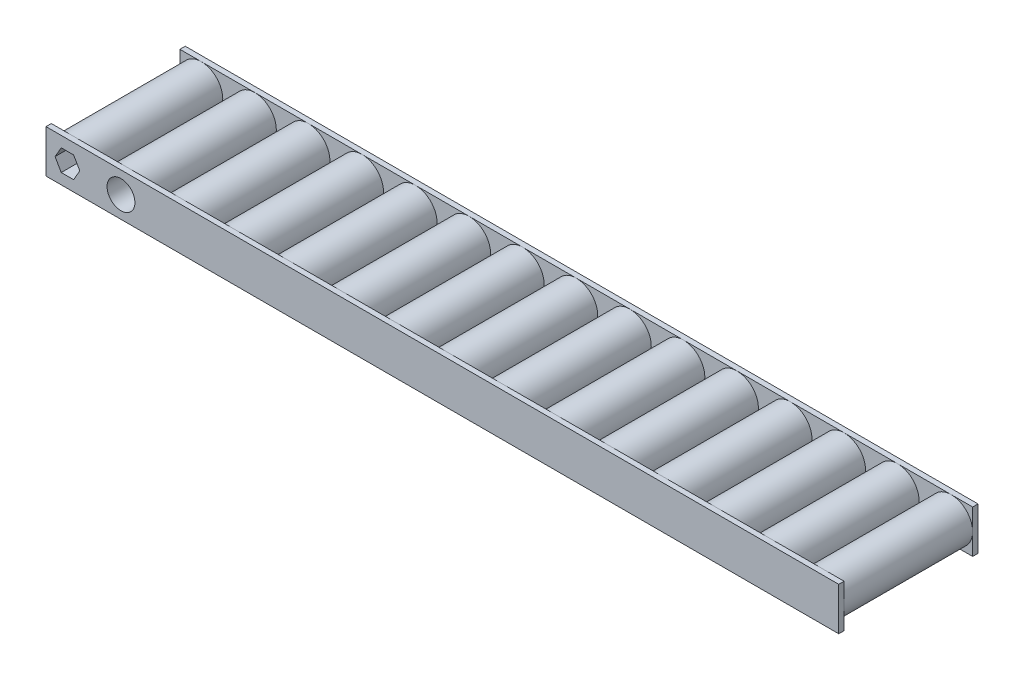
from build123d import *

# Parameters (mm, degrees)
SKETCH1_R           = 12.7
BOSS_EXTRUDE1_DEPTH = 76.2
LPATTERN1_COUNT     = 15
LPATTERN1_PITCH     = 31.75
SKETCH2_W           = 469.9
SKETCH2_H           = 25.4
BOSS_EXTRUDE2_DEPTH = 3.175
SKETCH3_R           = 8.255
CUT_EXTRUDE1_DEPTH  = 465.766212735


with BuildPart() as part:
    # Sketch1 → Boss-Extrude1 (new body)
    with BuildSketch(Plane.XY):
        with Locations(Location((0, 0, 0), (0, 0, 180))):
            Circle(SKETCH1_R)
    extrude(amount=BOSS_EXTRUDE1_DEPTH)


with BuildPart() as lpattern1_1:
    # LPattern1: pattern copy
    add(part.part.moved(Location(Vector(1, 0, 0) * (1 * LPATTERN1_PITCH))))


with BuildPart() as lpattern1_2:
    # LPattern1: pattern copy
    add(part.part.moved(Location(Vector(1, 0, 0) * (2 * LPATTERN1_PITCH))))


with BuildPart() as lpattern1_3:
    # LPattern1: pattern copy
    add(part.part.moved(Location(Vector(1, 0, 0) * (3 * LPATTERN1_PITCH))))


with BuildPart() as lpattern1_4:
    # LPattern1: pattern copy
    add(part.part.moved(Location(Vector(1, 0, 0) * (4 * LPATTERN1_PITCH))))


with BuildPart() as lpattern1_5:
    # LPattern1: pattern copy
    add(part.part.moved(Location(Vector(1, 0, 0) * (5 * LPATTERN1_PITCH))))


with BuildPart() as lpattern1_6:
    # LPattern1: pattern copy
    add(part.part.moved(Location(Vector(1, 0, 0) * (6 * LPATTERN1_PITCH))))


with BuildPart() as lpattern1_7:
    # LPattern1: pattern copy
    add(part.part.moved(Location(Vector(1, 0, 0) * (7 * LPATTERN1_PITCH))))


with BuildPart() as lpattern1_8:
    # LPattern1: pattern copy
    add(part.part.moved(Location(Vector(1, 0, 0) * (8 * LPATTERN1_PITCH))))


with BuildPart() as lpattern1_9:
    # LPattern1: pattern copy
    add(part.part.moved(Location(Vector(1, 0, 0) * (9 * LPATTERN1_PITCH))))


with BuildPart() as lpattern1_10:
    # LPattern1: pattern copy
    add(part.part.moved(Location(Vector(1, 0, 0) * (10 * LPATTERN1_PITCH))))


with BuildPart() as lpattern1_11:
    # LPattern1: pattern copy
    add(part.part.moved(Location(Vector(1, 0, 0) * (11 * LPATTERN1_PITCH))))


with BuildPart() as lpattern1_12:
    # LPattern1: pattern copy
    add(part.part.moved(Location(Vector(1, 0, 0) * (12 * LPATTERN1_PITCH))))


with BuildPart() as lpattern1_13:
    # LPattern1: pattern copy
    add(part.part.moved(Location(Vector(1, 0, 0) * (13 * LPATTERN1_PITCH))))


with BuildPart() as lpattern1_14:
    # LPattern1: pattern copy
    add(part.part.moved(Location(Vector(1, 0, 0) * (14 * LPATTERN1_PITCH))))


with BuildPart() as part_1:
    add(part.part)

    add(lpattern1_1.part)  # Boss-Extrude2 merges LPattern1_1

    add(lpattern1_2.part)  # Boss-Extrude2 merges LPattern1_2

    add(lpattern1_3.part)  # Boss-Extrude2 merges LPattern1_3

    add(lpattern1_4.part)  # Boss-Extrude2 merges LPattern1_4

    add(lpattern1_5.part)  # Boss-Extrude2 merges LPattern1_5

    add(lpattern1_6.part)  # Boss-Extrude2 merges LPattern1_6

    add(lpattern1_7.part)  # Boss-Extrude2 merges LPattern1_7

    add(lpattern1_8.part)  # Boss-Extrude2 merges LPattern1_8

    add(lpattern1_9.part)  # Boss-Extrude2 merges LPattern1_9

    add(lpattern1_10.part)  # Boss-Extrude2 merges LPattern1_10

    add(lpattern1_11.part)  # Boss-Extrude2 merges LPattern1_11

    add(lpattern1_12.part)  # Boss-Extrude2 merges LPattern1_12

    add(lpattern1_13.part)  # Boss-Extrude2 merges LPattern1_13

    add(lpattern1_14.part)  # Boss-Extrude2 merges LPattern1_14
    # Sketch2 → Boss-Extrude2 (add)
    with BuildSketch(Plane.XY.offset(76.2)):
        with Locations((222.25, 0)):
            Rectangle(SKETCH2_W, SKETCH2_H)
    boss_extrude2 = extrude(amount=BOSS_EXTRUDE2_DEPTH)

    # Mirror1: Boss-Extrude2 across plane
    add(boss_extrude2.mirror(Plane.XY.offset(38.1)))

    # Sketch3 → Cut-Extrude1 (cut, through all)
    with BuildSketch(Plane.XY.offset(79.375)):
        with Locations((31.75, 0)):
            Circle(SKETCH3_R)
        Polygon((7.332348419, 0), (3.666174209, 6.35), (-3.666174209, 6.35), (-7.332348419, 0), (-3.666174209, -6.35), (3.666174209, -6.35), align=None)
    extrude(amount=-CUT_EXTRUDE1_DEPTH, mode=Mode.SUBTRACT)


solid = part_1.part
